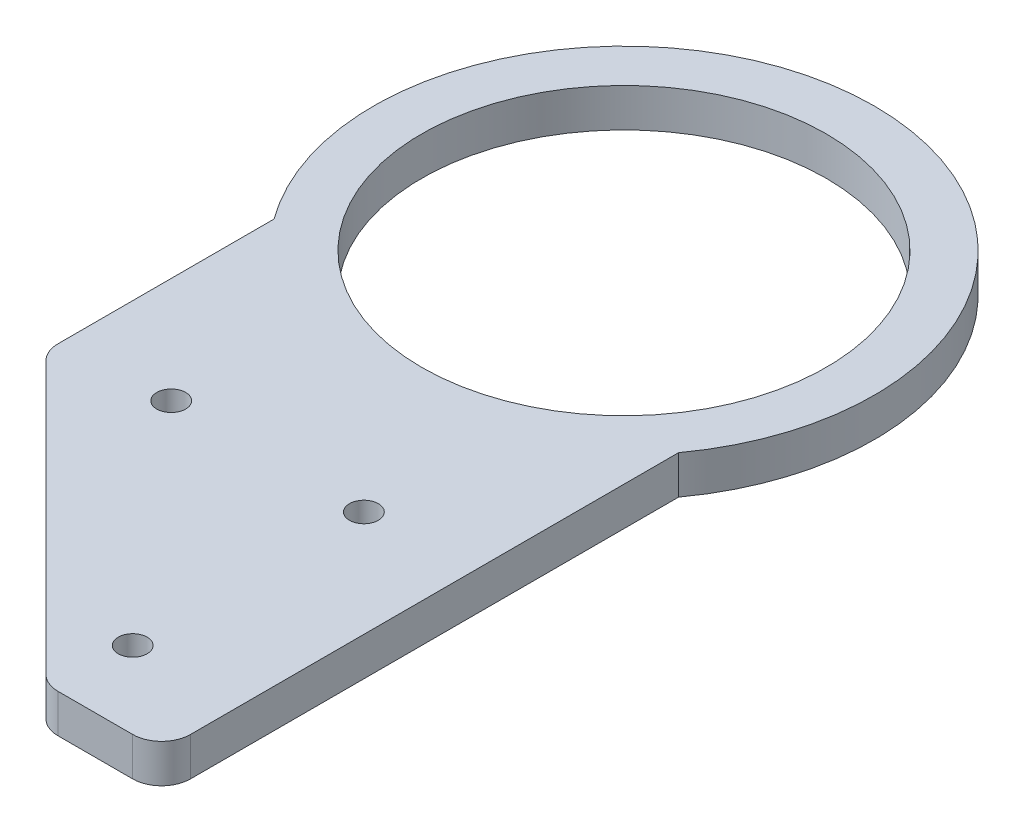
from build123d import *

# Parameters (mm, degrees)
SKETCH_2_R             = 1.5
SKETCH_2_R_2           = 9.5
EXTRUDE_1_DEPTH        = 4
CUT_EXTRUDE_1_DEPTH    = 124.429075185
EXTRUDE_2_DEPTH        = 4
SKETCH_7_R             = 1.5
CUT_EXTRUDE_2_DEPTH    = 155.008884812
FILLET_1_R             = 3
SKETCH_6_4_OUTSIDE_W   = 131.04
SKETCH_6_4_OUTSIDE_H   = 122.515
SKETCH_6_4_OUTSIDE_R   = 21
SKETCH_6_4_OUTSIDE_W_2 = 42
SKETCH_6_4_OUTSIDE_H_2 = 60
CUT_EXTRUDE_4_DEPTH    = 154.441846019
EXTRUDE_3_DEPTH        = 4
CUT_EXTRUDE_5_DEPTH    = 159.650559407
FILLET_2_R             = 3


with BuildPart() as part:
    # 草图2 → 凸台-拉伸1 (new body)
    with BuildSketch(Plane(origin=(0, 0, 0), x_dir=(1, 0, 0), z_dir=(0, 1, 0))):
        Polygon((0, 0), (0, 60), (40, 93.908128514), (80, 60), (80, 0), (68, 0), (68, 42), (40, 54), (12, 42), (12, 0), align=None)
        with Locations(Location((6, 32, 0), (0, 0, 270))):
            Circle(SKETCH_2_R, mode=Mode.SUBTRACT)
        with Locations(Location((6, 8, 0), (0, 0, 270))):
            Circle(SKETCH_2_R, mode=Mode.SUBTRACT)
        with Locations(Location((40, 69, 0), (0, 0, 270))):
            Circle(SKETCH_2_R_2, mode=Mode.SUBTRACT)
        with Locations(Location((74, 8, 0), (0, 0, 90))):
            Circle(SKETCH_2_R, mode=Mode.SUBTRACT)
        with Locations(Location((74, 32, 0), (0, 0, 90))):
            Circle(SKETCH_2_R, mode=Mode.SUBTRACT)
    extrude(amount=EXTRUDE_1_DEPTH)

    # 草图4 → 切除-拉伸1 (cut, through all)
    with BuildSketch(Plane(origin=(0, 4, 0), x_dir=(1, 0, 0), z_dir=(0, 1, 0))):
        with BuildLine():
            Line((24.36723091, 80.656179931), (0, 60))
            Line((0, 60), (0, 0))
            Line((0, 0), (12, 0))
            Line((12, 0), (12, 42))
            Line((12, 42), (32.756034747, 50.895443463))
            ThreePointArc((32.756034747, 50.895443463), (21.23136653, 63.709593809), (24.36723091, 80.656179931))
        make_face()
    extrude(amount=-CUT_EXTRUDE_1_DEPTH, mode=Mode.SUBTRACT)

    # 草图6 → 凸台-拉伸2 (add)
    with BuildSketch(Plane(origin=(0, 4, 0), x_dir=(1, 0, 0), z_dir=(0, 1, 0))):
        with BuildLine():
            Line((82.026334039, 60), (80, 60))
            Line((80, 60), (80, 0))
            Line((80, 0), (122, 0))
            Line((122, 0), (122, 60))
            Line((122, 60), (119.973665961, 60))
            ThreePointArc((119.973665961, 60), (101, 48), (82.026334039, 60))
        make_face()
    extrude(amount=-EXTRUDE_2_DEPTH)

    # 草图7 → 切除-拉伸2 (cut, through all)
    with BuildSketch(Plane(origin=(0, 4, 0), x_dir=(1, 0, 0), z_dir=(0, 1, 0))):
        with Locations(Location((91, 32, 0), (0, 0, 270))):
            Circle(SKETCH_7_R)
        with Locations(Location((74, 32, 0), (0, 0, 90))):
            Circle(SKETCH_7_R)
        with Locations(Location((74, 8, 0), (0, 0, 90))):
            Circle(SKETCH_7_R)
        with Locations(Location((111, 32, 0), (0, 0, 270))):
            Circle(SKETCH_7_R)
        with Locations(Location((111, 8, 0), (0, 0, 270))):
            Circle(SKETCH_7_R)
        with Locations(Location((91, 8, 0), (0, 0, 270))):
            Circle(SKETCH_7_R)
    extrude(amount=-CUT_EXTRUDE_2_DEPTH, mode=Mode.SUBTRACT)

    # 圆角1
    fillet_1_edges = [part.edges().sort_by_distance(p)[0] for p in [
        (40, 2, -93.908128514),
        (80, 2, -60),
        (68, 2, 0),
        (68, 2, -42),
        (40, 2, -54),
        (24.36723091, 2, -80.656179931),
        (32.756034747, 2, -50.895443463),
        (122, 2, 0),
    ]]
    fillet(fillet_1_edges, radius=FILLET_1_R)

    # 草图6<4> outside → 切除-拉伸4 (cut, through all)
    with BuildSketch(Plane(origin=(0, 4, 0), x_dir=(1, 0, 0), z_dir=(0, 1, 0))):
        with Locations((71.25, 46.4875)):
            Rectangle(SKETCH_6_4_OUTSIDE_W, SKETCH_6_4_OUTSIDE_H)
        with Locations((101, 69)):
            Circle(SKETCH_6_4_OUTSIDE_R, mode=Mode.SUBTRACT)
        with Locations((101, 30)):
            Rectangle(SKETCH_6_4_OUTSIDE_W_2, SKETCH_6_4_OUTSIDE_H_2, mode=Mode.SUBTRACT)
    extrude(amount=-CUT_EXTRUDE_4_DEPTH, mode=Mode.SUBTRACT)

    # 草图8 → 凸台-拉伸3 (add)
    with BuildSketch(Plane(origin=(0, 4, 0), x_dir=(1, 0, 0), z_dir=(0, 1, 0))):
        with BuildLine():
            ThreePointArc((119.973665961, 60), (101, 48), (82.026334039, 60))
            Line((82.026334039, 60), (80, 60))
            Line((80, 60), (80, 53.670290283))
            ThreePointArc((80, 53.670290283), (101, 43), (122, 53.670290283))
            Line((122, 53.670290283), (122, 60))
            Line((122, 60), (119.973665961, 60))
        make_face()
        with BuildLine():
            Line((80, 60), (82.026334039, 60))
            ThreePointArc((82.026334039, 60), (96.387353535, 89.487154331), (122, 69))
            ThreePointArc((122, 69), (121.487154331, 64.387353535), (119.973665961, 60))
            Line((119.973665961, 60), (122, 60))
            Line((122, 60), (122, 53.670290283))
            ThreePointArc((122, 53.670290283), (125.718414189, 60.937742252), (127, 69))
            ThreePointArc((127, 69), (92.937742252, 93.718414189), (80, 53.670290283))
            Line((80, 53.670290283), (80, 60))
        make_face()
    extrude(amount=-EXTRUDE_3_DEPTH)

    # 草图9 → 切除-拉伸5 (cut, through all)
    with BuildSketch(Plane.XZ):
        Polygon((110, 0), (80, -30), (80, 0), align=None)
    extrude(amount=-CUT_EXTRUDE_5_DEPTH, mode=Mode.SUBTRACT)

    # 圆角2
    fillet_2_edges = [part.edges().sort_by_distance(p)[0] for p in [
        (110, 2, 0),
        (80, 2, -30),
    ]]
    fillet(fillet_2_edges, radius=FILLET_2_R)


solid = part.part
